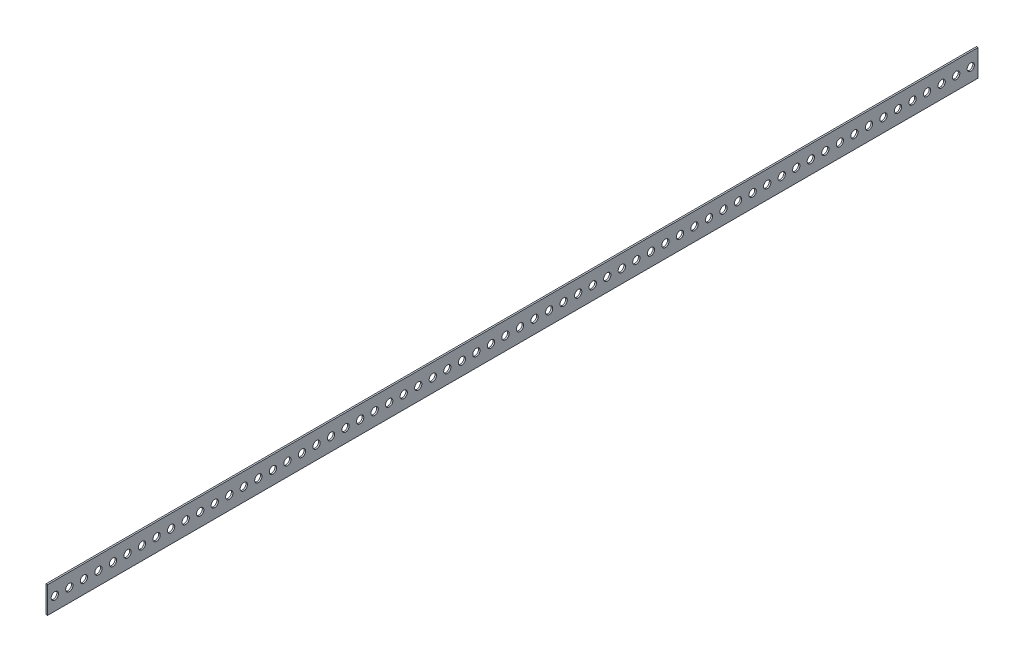
from build123d import *

# Parameters (mm, degrees)
SKETCH1_W           = 2.032
SKETCH1_H           = 34.925
BOSS_EXTRUDE1_DEPTH = 609.6
CUT_EXTRUDE1_REACH  = 612.603
SKETCH2_R           = 4.7625
LPATTERN1_COUNT     = 64
LPATTERN1_PITCH     = 19.05


with BuildPart() as part:
    # Sketch1 → Boss-Extrude1 (new, symmetric)
    with BuildSketch(Plane.XY):
        with Locations((1.016, 17.4625)):
            Rectangle(SKETCH1_W, SKETCH1_H)
    extrude(amount=BOSS_EXTRUDE1_DEPTH, both=True)

    # Sketch2 → Cut-Extrude1 (cut, up to next)
    with BuildSketch(Plane.ZY, mode=Mode.PRIVATE) as cut_extrude1_sk1:
        with Locations((600.075, 17.4625)):
            Circle(SKETCH2_R)
    cut_extrude1_tool1 = extrude(cut_extrude1_sk1.sketch, amount=-CUT_EXTRUDE1_REACH, mode=Mode.PRIVATE) & part.part
    cut_extrude1 = cut_extrude1_tool1.solids().sort_by_distance((0, 17.4625, 600.075))[0]
    add(cut_extrude1, mode=Mode.SUBTRACT)

    # LPattern1: Cut-Extrude1 ×64
    with Locations(*[(0, 0, -i * LPATTERN1_PITCH) for i in range(1, LPATTERN1_COUNT)]):
        add(cut_extrude1, mode=Mode.SUBTRACT)


solid = part.part
